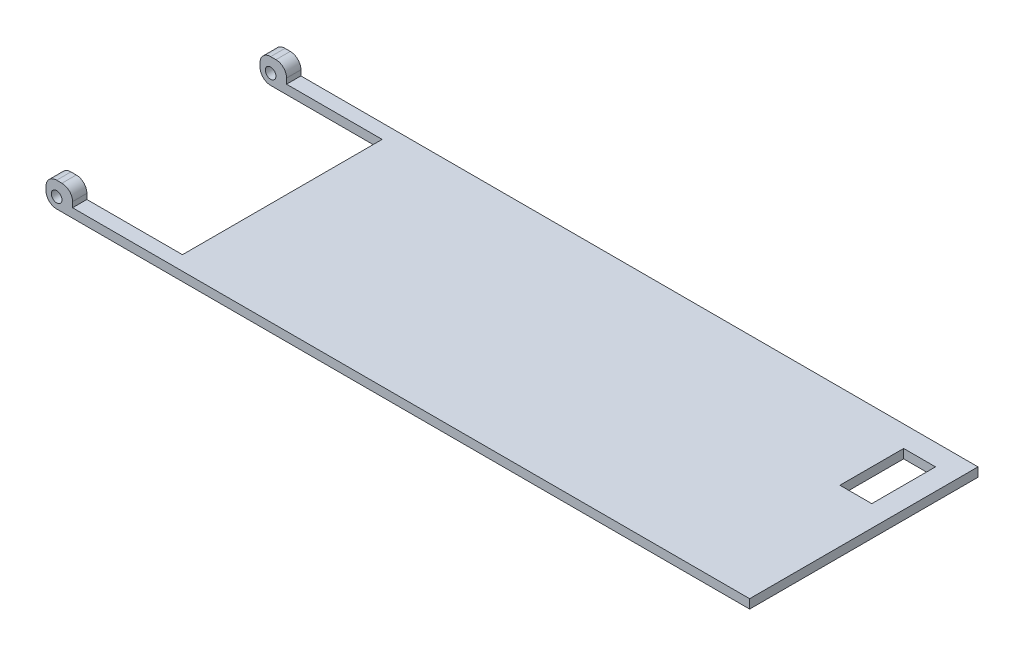
from build123d import *

# Parameters (mm, degrees)
SKETCH1_W            = 132.5
SKETCH1_H            = 43
BOSS_EXTRUDE1_DEPTH  = 1.7
SKETCH2_W            = 23
SKETCH2_H            = 37.6
CUT_EXTRUDE1_DEPTH   = 1.7
SKETCH4_W            = 5
SKETCH4_H            = 2.7
BOSS_EXTRUDE2_DEPTH  = 3
SKETCH5_R            = 1
CUT_EXTRUDE2_DEPTH   = 2.7
FILLET1_R            = 2
FILLET1_OF_MIRROR2_R = 2
SKETCH10_W           = 6
SKETCH10_H           = 12
CUT_EXTRUDE3_DEPTH   = 1.7


with BuildPart() as part:
    # Sketch1 → Boss-Extrude1 (new body)
    with BuildSketch(Plane(origin=(0, 0, 0), x_dir=(1, 0, 0), z_dir=(0, 1, 0))):
        Rectangle(SKETCH1_W, SKETCH1_H)
    extrude(amount=BOSS_EXTRUDE1_DEPTH)

    # Sketch2 → Cut-Extrude1 (cut)
    with BuildSketch(Plane(origin=(0, 1.7, 0), x_dir=(1, 0, 0), z_dir=(0, 1, 0))):
        with Locations((-54.75, 0)):
            Rectangle(SKETCH2_W, SKETCH2_H)
    extrude(amount=-CUT_EXTRUDE1_DEPTH, mode=Mode.SUBTRACT)

    # Sketch4 → Boss-Extrude2 (add)
    with BuildSketch(Plane(origin=(0, 1.7, 0), x_dir=(1, 0, 0), z_dir=(0, 1, 0))):
        with Locations((-63.75, -20.15)):
            Rectangle(SKETCH4_W, SKETCH4_H)
    boss_extrude2 = extrude(amount=BOSS_EXTRUDE2_DEPTH)

    # Sketch5 → Cut-Extrude2 (cut)
    with BuildSketch(Plane.XY.offset(21.5)):
        with Locations((-64.25, 2)):
            Circle(SKETCH5_R)
    cut_extrude2 = extrude(amount=-CUT_EXTRUDE2_DEPTH, mode=Mode.SUBTRACT)

    # Fillet1
    fillet1_edges = [part.edges().sort_by_distance(p)[0] for p in [
        (-66.25, 0, 20.15),
        (-66.25, 4.7, 20.15),
        (-61.25, 4.7, 20.15),
    ]]
    fillet(fillet1_edges, radius=FILLET1_R)

    # Mirror2: Boss-Extrude2, Cut-Extrude2 across plane
    add(boss_extrude2.mirror(Plane.XY))
    add(cut_extrude2.mirror(Plane.XY), mode=Mode.SUBTRACT)

    # Fillet1 of Mirror2
    fillet1_of_mirror2_edges = [part.edges().sort_by_distance(p)[0] for p in [
        (-66.25, 0, -20.15),
        (-66.25, 4.7, -20.15),
        (-61.25, 4.7, -20.15),
    ]]
    fillet(fillet1_of_mirror2_edges, radius=FILLET1_OF_MIRROR2_R)

    # Sketch10 → Cut-Extrude3 (cut)
    with BuildSketch(Plane(origin=(0, 1.7, 0), x_dir=(1, 0, 0), z_dir=(0, 1, 0))):
        with Locations((59.25, 11.5)):
            Rectangle(SKETCH10_W, SKETCH10_H)
    extrude(amount=-CUT_EXTRUDE3_DEPTH, mode=Mode.SUBTRACT)


solid = part.part
